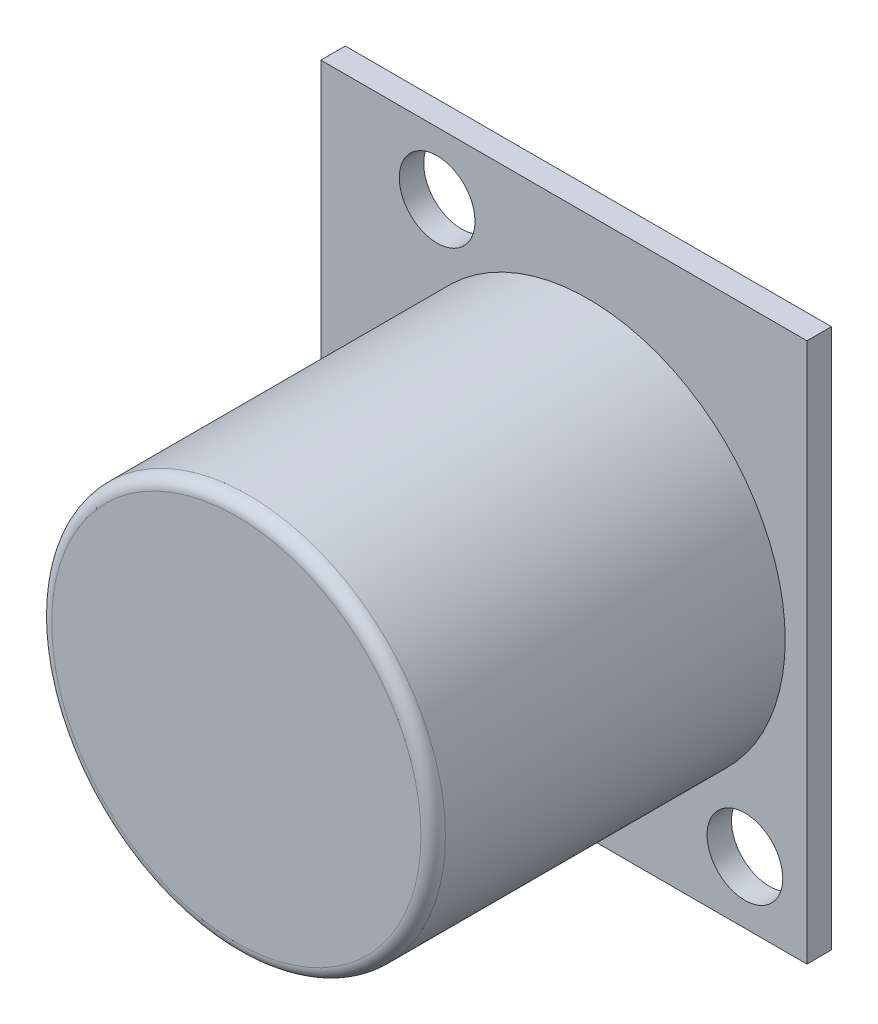
from build123d import *

# Parameters (mm, degrees)
SKETCH1_W      = 19.9
SKETCH1_H      = 22.1
EXTRUDE1_DEPTH = 1
SKETCH2_R      = 1.55
EXTRUDE2_DEPTH = 1
SKETCH3_R      = 8.06
EXTRUDE3_DEPTH = 14.41
FILLET1_R      = 0.5


with BuildPart() as part:
    # Sketch1 → Extrude1 (new body)
    with BuildSketch(Plane.XY):
        with Locations((9.95, -11.05)):
            Rectangle(SKETCH1_W, SKETCH1_H)
    extrude(amount=EXTRUDE1_DEPTH)

    # Sketch2 → Extrude2 (cut)
    with BuildSketch(Plane.XY.offset(1)):
        with Locations((4.76, -2.56)):
            Circle(SKETCH2_R)
        with Locations((17.36, -19.56)):
            Circle(SKETCH2_R)
    extrude(amount=-EXTRUDE2_DEPTH, mode=Mode.SUBTRACT)

    # Sketch3 → Extrude3 (add)
    with BuildSketch(Plane.XY.offset(1)):
        with Locations((10.95, -11.05)):
            Circle(SKETCH3_R)
    extrude(amount=EXTRUDE3_DEPTH)

    # Fillet1
    fillet1_edges = [part.edges().sort_by_distance(p)[0] for p in [
        (2.89, -11.05, 15.41),
    ]]
    fillet(fillet1_edges, radius=FILLET1_R)


solid = part.part
